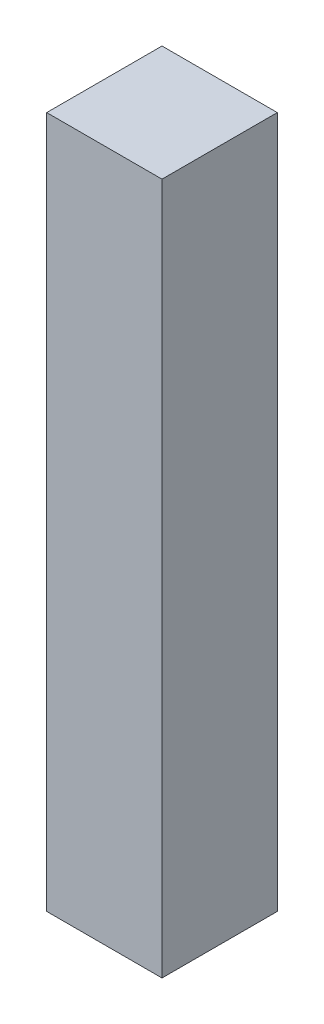
from build123d import *

# Parameters (mm, degrees)
SKETCH1_W           = 5
SKETCH1_H           = 5
BOSS_EXTRUDE1_DEPTH = 30


with BuildPart() as part:
    # Sketch1 → Boss-Extrude1 (new body)
    with BuildSketch(Plane(origin=(0, 0, 0), x_dir=(1, 0, 0), z_dir=(0, 1, 0))):
        Rectangle(SKETCH1_W, SKETCH1_H)
    extrude(amount=BOSS_EXTRUDE1_DEPTH)


solid = part.part
